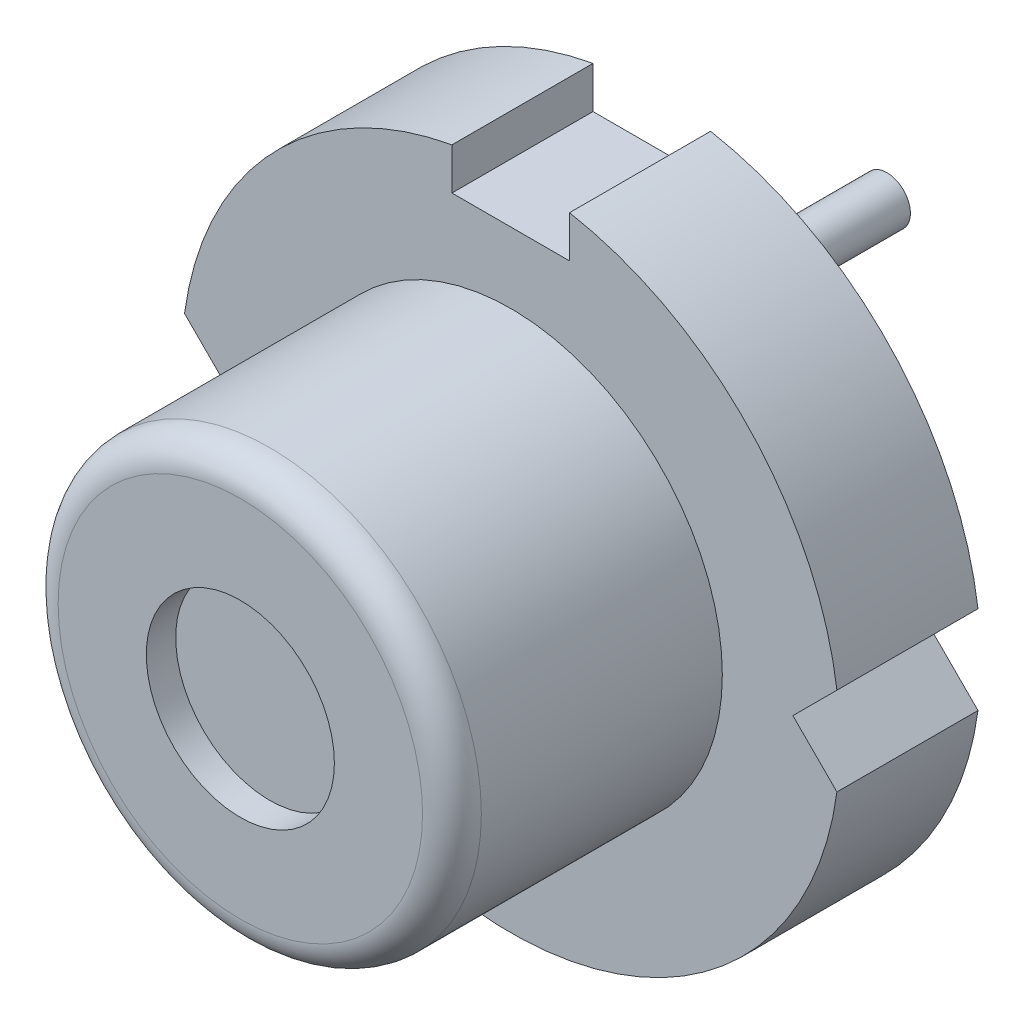
from build123d import *

# Parameters (mm, degrees)
SKETCH1_W                  = 2.8
SKETCH1_H                  = 1.2
CUT_EXTRUDE1_DEPTH         = 5.137632173
CUT_EXTRUDE2_DEPTH         = 5.137632173
CUT_EXTRUDE3_START         = -1.2
CUT_EXTRUDE3_DEPTH         = 1.2
F_0_9_0_9_DIAMETER_HOLE1_D = 0.9
F_0_9_0_9_DIAMETER_HOLE2_D = 0.9
SKETCH9_W                  = 1.8
SKETCH9_H                  = 2.3
SKETCH10_W                 = 0.2
SKETCH10_H                 = 2
SKETCH11_W                 = 0.2
SKETCH11_H                 = 2.25
SKETCH12_W                 = 0.2
SKETCH12_H                 = 2.25
SKETCH13_W                 = 0.8
SKETCH13_H                 = 0.25
FILLET1_R                  = 0.25


with BuildPart() as part:
    # Sketch1 → Revolve1 (revolve)
    with BuildSketch(Plane(origin=(0, 0, 0), x_dir=(1, 0, 0), z_dir=(0, 1, 0))):
        with Locations((1.4, -0.6)):
            Rectangle(SKETCH1_W, SKETCH1_H)
    revolve(axis=Axis((0, 0, 0), (0, 0, 1)))

    # Sketch2 → Cut-Extrude1 (cut, through all)
    with BuildSketch(Plane.XY.offset(1.2)):
        with BuildLine():
            Line((2.774801575, 0.374801575), (2.4, 0))
            Line((2.4, 0), (2.774801575, -0.374801575))
            ThreePointArc((2.774801575, -0.374801575), (2.8, 0), (2.774801575, 0.374801575))
        make_face()
    extrude(amount=-CUT_EXTRUDE1_DEPTH, mode=Mode.SUBTRACT)

    # Sketch3 → Cut-Extrude2 (cut, through all)
    with BuildSketch(Plane.XY.offset(1.2)):
        with BuildLine():
            Line((-2.774801575, -0.374801575), (-2.4, 0))
            Line((-2.4, 0), (-2.774801575, 0.374801575))
            ThreePointArc((-2.774801575, 0.374801575), (-2.8, 0), (-2.774801575, -0.374801575))
        make_face()
    extrude(amount=-CUT_EXTRUDE2_DEPTH, mode=Mode.SUBTRACT)

    # Sketch4 → Cut-Extrude3 (cut)
    with BuildSketch(Plane.XY.offset(1.2).offset(CUT_EXTRUDE3_START)):
        with BuildLine():
            Line((-0.5, 2.754995463), (-0.5, 2.4))
            Line((-0.5, 2.4), (0.5, 2.4))
            Line((0.5, 2.4), (0.5, 2.754995463))
            ThreePointArc((0.5, 2.754995463), (0, 2.8), (-0.5, 2.754995463))
        make_face()
    extrude(amount=CUT_EXTRUDE3_DEPTH, mode=Mode.SUBTRACT)

    # Ø0.9 (0.9) Diameter Hole1 (through all)
    with Locations(Plane(origin=(0, 0, 0), x_dir=(-1, 0, 0), z_dir=(0, 0, -1))):
        with Locations((0, 1)):
            Hole(F_0_9_0_9_DIAMETER_HOLE1_D / 2)

    # Ø0.9 (0.9) Diameter Hole2 (through all)
    with Locations(Plane(origin=(0, 0, 0), x_dir=(-1, 0, 0), z_dir=(0, 0, -1))):
        with Locations((0, -1)):
            Hole(F_0_9_0_9_DIAMETER_HOLE2_D / 2)

    # Sketch9 → Revolve2 (revolve)
    with BuildSketch(Plane(origin=(0, 0, 0), x_dir=(1, 0, 0), z_dir=(0, 1, 0))):
        with Locations((0.9, -2.35)):
            Rectangle(SKETCH9_W, SKETCH9_H)
    revolve(axis=Axis((0, 0, 1.2), (0, 0, 1)))

    # Sketch10 → Revolve3 (revolve)
    with BuildSketch(Plane.XZ, mode=Mode.PRIVATE) as revolve3_sk:
        with Locations((-0.9, -1)):
            Rectangle(SKETCH10_W, SKETCH10_H)
    revolve(revolve3_sk.sketch.rotate(Axis((-1, 0, 0), (0, 0, -1)), 180), axis=Axis((-1, 0, 0), (0, 0, -1)))

    # Sketch13 → Ø1.6 (1.6) Diameter Hole1 (revolve, cut)
    with BuildSketch(Plane(origin=(0, 0, 3.5), x_dir=(0, -1, 0), z_dir=(1, 0, 0))):
        with Locations((0.4, 0.125)):
            Rectangle(SKETCH13_W, SKETCH13_H)
    revolve(axis=Axis((0, 0, 9.85), (0, 0, -1)), mode=Mode.SUBTRACT)

    # Fillet1
    fillet1_edges = [part.edges().sort_by_distance(p)[0] for p in [
        (-1.8, 0, 3.5),
    ]]
    fillet(fillet1_edges, radius=FILLET1_R)


with BuildPart() as body_2:
    # Sketch11 → Revolve4 (revolve)
    with BuildSketch(Plane.XZ.offset(1), mode=Mode.PRIVATE) as revolve4_sk:
        with Locations((0.1, -0.875)):
            Rectangle(SKETCH11_W, SKETCH11_H)
    revolve(revolve4_sk.sketch.rotate(Axis((0, -1, 0.25), (0, 0, -1)), 180), axis=Axis((0, -1, 0.25), (0, 0, -1)))


with BuildPart() as body_3:
    # Sketch12 → Revolve5 (revolve)
    with BuildSketch(Plane.XZ.offset(-1), mode=Mode.PRIVATE) as revolve5_sk:
        with Locations((0.1, -0.875)):
            Rectangle(SKETCH12_W, SKETCH12_H)
    revolve(revolve5_sk.sketch.rotate(Axis((0, 1, 0.25), (0, 0, -1)), 180), axis=Axis((0, 1, 0.25), (0, 0, -1)))


solid = Compound([part.part, body_2.part, body_3.part])
